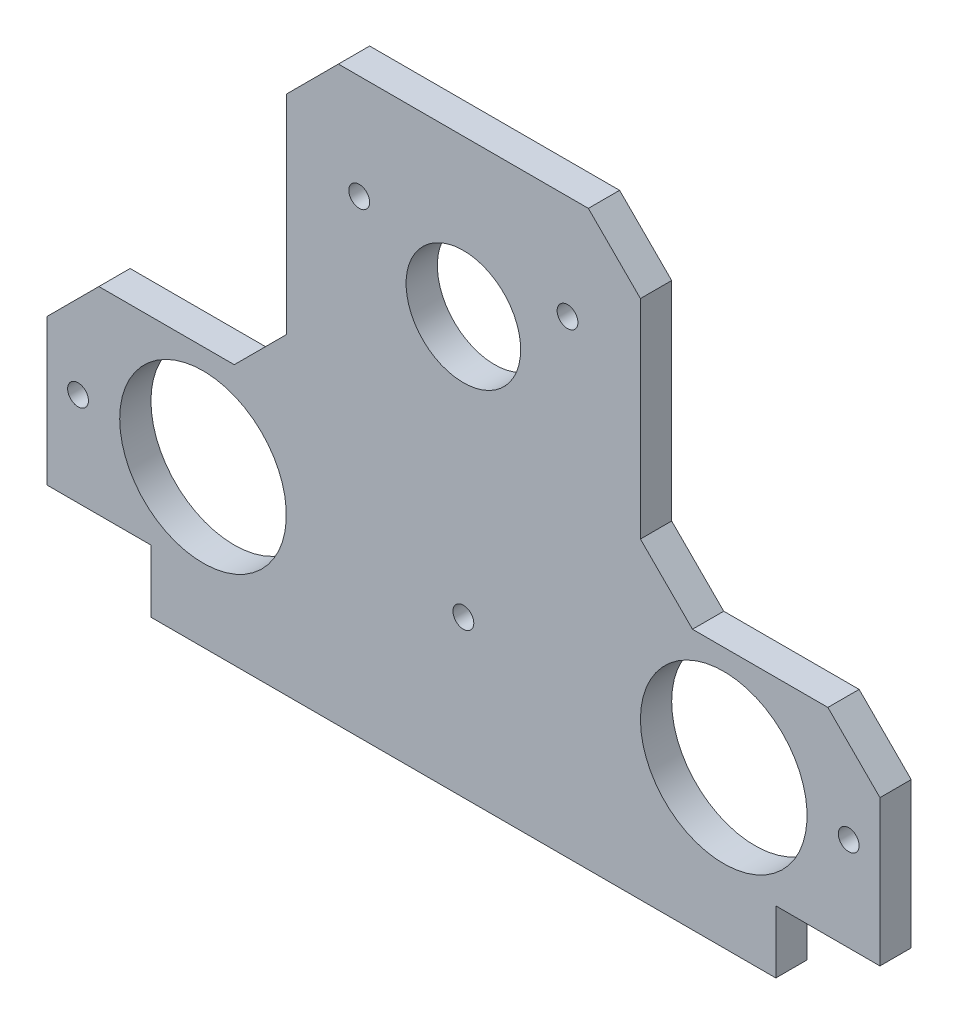
from build123d import *

# Parameters (mm, degrees)
ESQUISSE1_R             = 13
BOSS_EXTRU_1_DEPTH      = 12
BOSS_EXTRU_2_START      = -12
ESQUISSE2_R             = 13
ESQUISSE2_R_2           = 5.5
BOSS_EXTRU_2_DEPTH      = 3
ESQUISSE4_R             = 8
ENL_V_MAT_EXTRU_2_DEPTH = 6
ESQUISSE5_R             = 3
ENL_V_MAT_EXTRU_3_DEPTH = 69.271516755
ESQUISSE6_W             = 10
ESQUISSE6_H             = 6
ENL_V_MAT_EXTRU_4_DEPTH = 12
CHANFREIN1_SIZE         = 5
ESQUISSE7_R             = 1
ENL_V_MAT_EXTRU_5_DEPTH = 12
ESQUISSE8_W             = 80
ESQUISSE8_H             = 9
ENL_V_MAT_EXTRU_6_DEPTH = 70.057946682


with BuildPart() as part:
    # Esquisse1 → Boss.-Extru.1 (new body)
    with BuildSketch(Plane.XY):
        Polygon((-40, 0), (40, 0), (40, 25), (17, 25), (17, 55), (-17, 55), (-17, 25), (-40, 25), align=None)
        with Locations((0, 40)):
            Circle(ESQUISSE1_R, mode=Mode.SUBTRACT)
    extrude(amount=BOSS_EXTRU_1_DEPTH)

    # Esquisse2 → Boss.-Extru.2 (add)
    with BuildSketch(Plane.XY.offset(12).offset(BOSS_EXTRU_2_START)):
        with Locations((0, 40)):
            Circle(ESQUISSE2_R)
        with Locations((0, 40)):
            Circle(ESQUISSE2_R_2, mode=Mode.SUBTRACT)
    extrude(amount=BOSS_EXTRU_2_DEPTH)

    # Esquisse4 → Enlèv. mat.-Extru.2 (cut)
    with BuildSketch(Plane(origin=(0, 0, 0), x_dir=(-1, 0, 0), z_dir=(0, 0, -1))):
        with Locations((-25, 15)):
            Circle(ESQUISSE4_R)
        with Locations(Location((25, 15, 0), (0, 0, 180))):
            Circle(ESQUISSE4_R)
    extrude(amount=-ENL_V_MAT_EXTRU_2_DEPTH, mode=Mode.SUBTRACT)

    # Esquisse5 → Enlèv. mat.-Extru.3 (cut, through all)
    with BuildSketch(Plane(origin=(0, 0, 6), x_dir=(-1, 0, 0), z_dir=(0, 0, -1))):
        with Locations((-25, 15)):
            Circle(ESQUISSE5_R)
        with Locations(Location((25, 15, 0), (0, 0, 180))):
            Circle(ESQUISSE5_R)
    extrude(amount=-ENL_V_MAT_EXTRU_3_DEPTH, mode=Mode.SUBTRACT)

    # Esquisse6 → Enlèv. mat.-Extru.4 (cut)
    with BuildSketch(Plane.XY.offset(12)):
        with Locations((35, 3)):
            Rectangle(ESQUISSE6_W, ESQUISSE6_H)
        with Locations((-35, 3)):
            Rectangle(ESQUISSE6_W, ESQUISSE6_H)
    extrude(amount=-ENL_V_MAT_EXTRU_4_DEPTH, mode=Mode.SUBTRACT)

    # Chanfrein1
    chanfrein1_edges = [part.edges().sort_by_distance(p)[0] for p in [
        (-17, 55, 6),
        (17, 55, 6),
        (17, 25, 6),
        (40, 25, 6),
        (-40, 25, 6),
        (-17, 25, 6),
    ]]
    chamfer(chanfrein1_edges, length=CHANFREIN1_SIZE)

    # Esquisse7 → Enlèv. mat.-Extru.5 (cut)
    with BuildSketch(Plane(origin=(0, 0, 0), x_dir=(-1, 0, 0), z_dir=(0, 0, -1))):
        with Locations((-10, 45)):
            Circle(ESQUISSE7_R)
        with Locations(Location((10, 45, 0), (0, 0, 180))):
            Circle(ESQUISSE7_R)
        with Locations((-37, 15)):
            Circle(ESQUISSE7_R)
        with Locations(Location((37, 15, 0), (0, 0, 180))):
            Circle(ESQUISSE7_R)
        with Locations((0, 15)):
            Circle(ESQUISSE7_R)
    extrude(amount=-ENL_V_MAT_EXTRU_5_DEPTH, mode=Mode.SUBTRACT)

    # Esquisse8 → Enlèv. mat.-Extru.6 (cut, through all)
    with BuildSketch(Plane(origin=(0, 55, 0), x_dir=(1, 0, 0), z_dir=(0, 1, 0))):
        with Locations((0, -7.5)):
            Rectangle(ESQUISSE8_W, ESQUISSE8_H)
    extrude(amount=-ENL_V_MAT_EXTRU_6_DEPTH, mode=Mode.SUBTRACT)


solid = part.part
